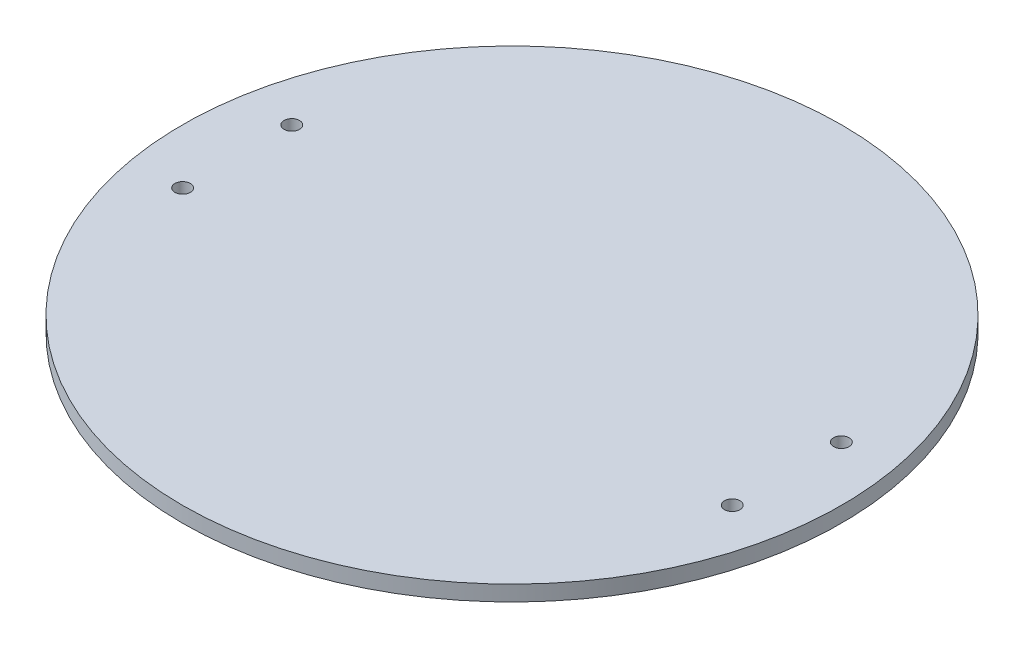
from build123d import *

# Parameters (mm, degrees)
SKETCH1_R           = 85
BOSS_EXTRUDE1_DEPTH = 2
SKETCH2_R           = 2
CUT_EXTRUDE1_DEPTH  = 121.274685616


with BuildPart() as part:
    # Sketch1 → Boss-Extrude1 (new, symmetric)
    with BuildSketch(Plane(origin=(0, 0, 0), x_dir=(1, 0, 0), z_dir=(0, 1, 0))):
        with Locations(Location((0, 0, 0), (0, 0, 270))):
            Circle(SKETCH1_R)
    extrude(amount=BOSS_EXTRUDE1_DEPTH, both=True)

    # Sketch2 → Cut-Extrude1 (cut, through all)
    with BuildSketch(Plane(origin=(0, 2, 0), x_dir=(1, 0, 0), z_dir=(0, 1, 0))):
        with Locations(Location((70.87, 14.075, 0), (0, 0, 270))):
            Circle(SKETCH2_R)
        with Locations(Location((70.87, -14.075, 0), (0, 0, 90))):
            Circle(SKETCH2_R)
        with Locations(Location((-70.87, -14.075, 0), (0, 0, 270))):
            Circle(SKETCH2_R)
        with Locations(Location((-70.87, 14.075, 0), (0, 0, 90))):
            Circle(SKETCH2_R)
    extrude(amount=-CUT_EXTRUDE1_DEPTH, mode=Mode.SUBTRACT)


solid = part.part
